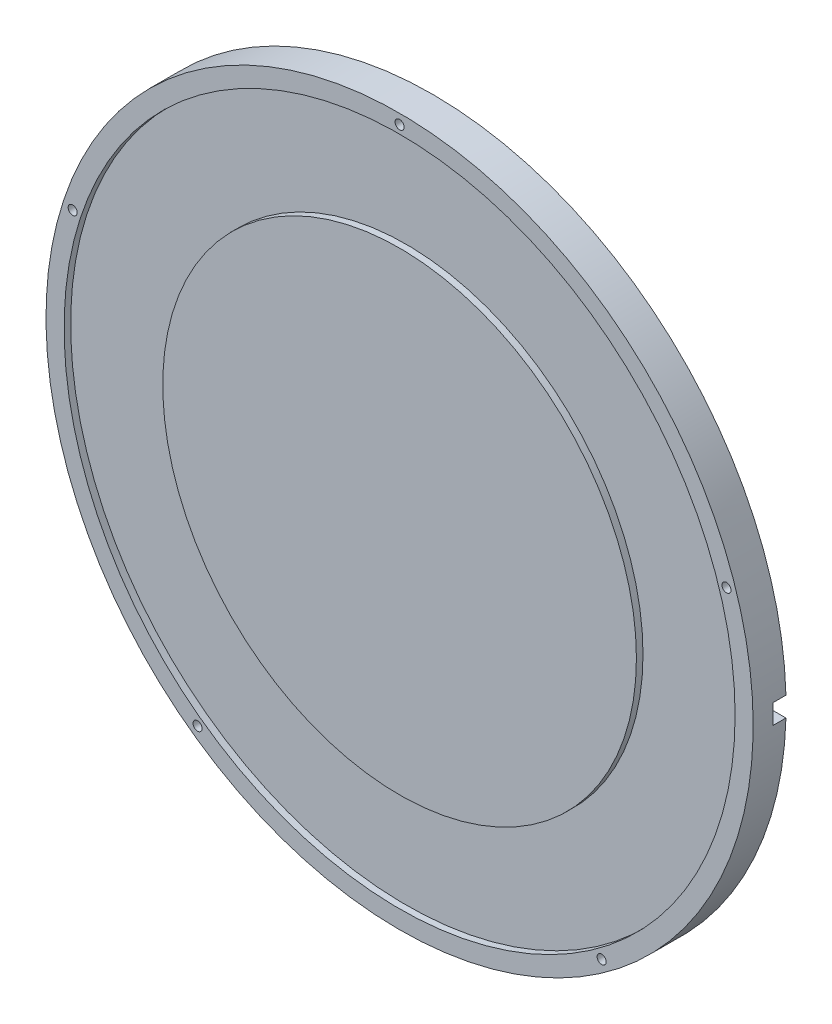
from build123d import *

# Parameters (mm, degrees)
SKETCH1_R           = 215
PLATE_DEPTH         = 20
SKETCH2_R           = 204
SKETCH2_R_2         = 144
COMB_GROOVE_DEPTH   = 4
SKETCH3_R           = 2.75
ROD_HOLES_DEPTH     = 20
SKETCH4_R           = 5
NUT_POCKETS_DEPTH   = 6
SKETCH5_W           = 40
SKETCH5_H           = 30
PD_POCKET_DEPTH     = 8
SKETCH6_W           = 60
SKETCH6_H           = 12
CABLE_CHANNEL_DEPTH = 8


with BuildPart() as part:
    # Sketch1 → Plate (new body)
    with BuildSketch(Plane.XY):
        Circle(SKETCH1_R)
    extrude(amount=PLATE_DEPTH)

    # Sketch2 → Comb_groove (cut)
    with BuildSketch(Plane.XY.offset(16)):
        Circle(SKETCH2_R)
        Circle(SKETCH2_R_2, mode=Mode.SUBTRACT)
    extrude(amount=COMB_GROOVE_DEPTH, mode=Mode.SUBTRACT)

    # Sketch3 → Rod_holes (cut)
    with BuildSketch(Plane.XY):
        with Locations((198.770811906, 64.584551824)):
            Circle(SKETCH3_R)
        with Locations((0, 209)):
            Circle(SKETCH3_R)
        with Locations((-198.770811906, 64.584551824)):
            Circle(SKETCH3_R)
        with Locations((-122.847117729, -169.084551824)):
            Circle(SKETCH3_R)
        with Locations((122.847117729, -169.084551824)):
            Circle(SKETCH3_R)
    extrude(amount=ROD_HOLES_DEPTH, mode=Mode.SUBTRACT)

    # Sketch4 → Nut_pockets (cut)
    with BuildSketch(Plane.XY):
        with Locations((198.770811906, 64.584551824)):
            Circle(SKETCH4_R)
        with Locations((0, 209)):
            Circle(SKETCH4_R)
        with Locations((-198.770811906, 64.584551824)):
            Circle(SKETCH4_R)
        with Locations((-122.847117729, -169.084551824)):
            Circle(SKETCH4_R)
        with Locations((122.847117729, -169.084551824)):
            Circle(SKETCH4_R)
    extrude(amount=NUT_POCKETS_DEPTH, mode=Mode.SUBTRACT)

    # Sketch5 → PD_pocket (cut)
    with BuildSketch(Plane.XY):
        with Locations((145, 0)):
            Rectangle(SKETCH5_W, SKETCH5_H)
    extrude(amount=PD_POCKET_DEPTH, mode=Mode.SUBTRACT)

    # Sketch6 → Cable_channel (cut)
    with BuildSketch(Plane.XY):
        with Locations((190, 0)):
            Rectangle(SKETCH6_W, SKETCH6_H)
    extrude(amount=CABLE_CHANNEL_DEPTH, mode=Mode.SUBTRACT)


solid = part.part
